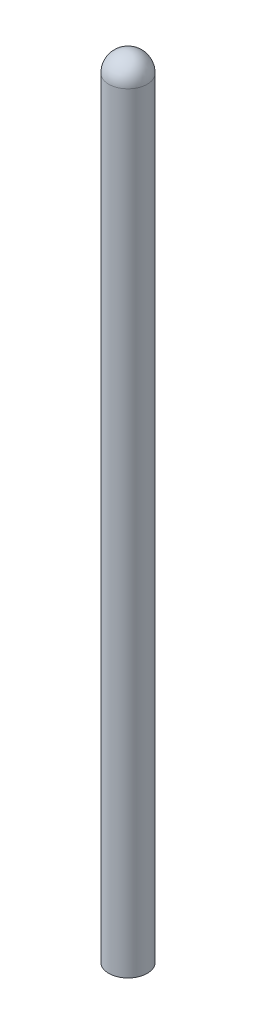
from build123d import *

# Parameters (mm, degrees)
SKETCH_1_R      = 0.75
EXTRUDE_1_DEPTH = 30


with BuildPart() as part:
    # 草图1 → 凸台-拉伸1 (new body)
    with BuildSketch(Plane(origin=(0, 0, 0), x_dir=(1, 0, 0), z_dir=(0, 1, 0))):
        with Locations(Location((0, 0, 0), (0, 0, 270))):
            Circle(SKETCH_1_R)
    extrude(amount=EXTRUDE_1_DEPTH)

    # 草图2 → 旋转1 (revolve)
    with BuildSketch(Plane(origin=(0, 0, 0), x_dir=(0, 0, -1), z_dir=(1, 0, 0))):
        with BuildLine():
            Line((0, 30.75), (0, 29.25))
            ThreePointArc((0, 29.25), (0.75, 30), (0, 30.75))
        make_face()
    revolve(axis=Axis((0, 30.75, 0), (0, -1, 0)))


solid = part.part
